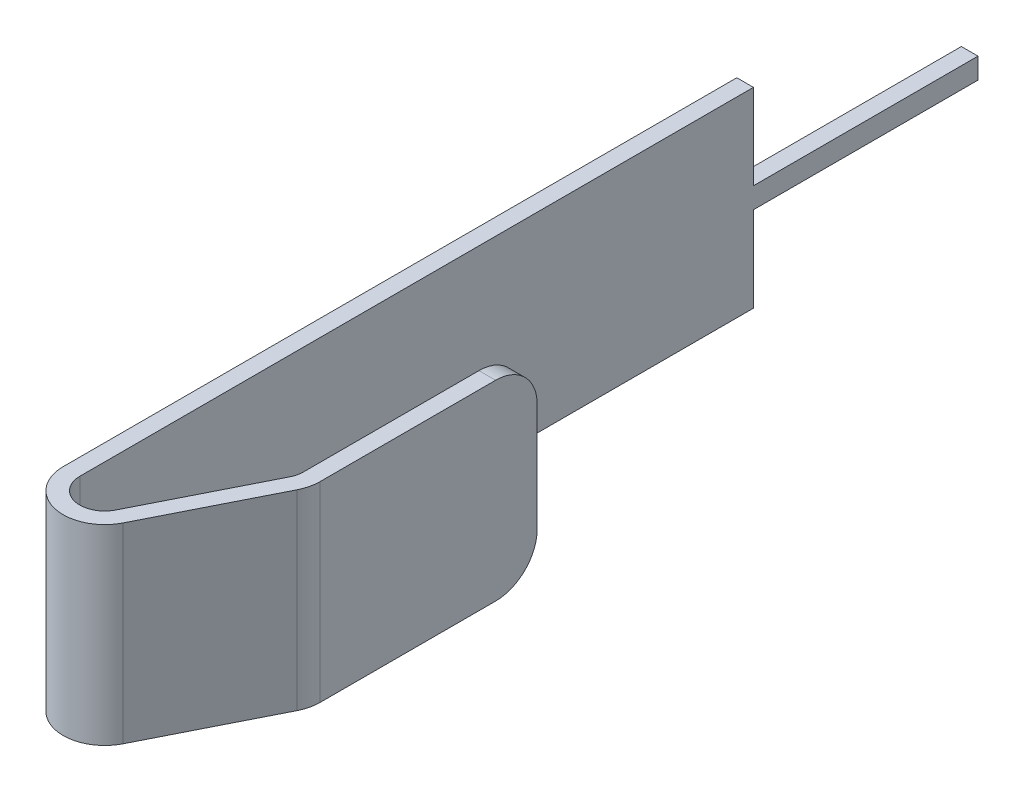
from build123d import *

# Parameters (mm, degrees)
EXTRUDE_THIN1_DEPTH = 2.921
FILLET1_R           = 1.27
SKETCH2_W           = 6.858
SKETCH2_H           = 2.6035
CUT_EXTRUDE1_DEPTH  = 23.45746426


with BuildPart() as part:
    # Sketch1 → Extrude-Thin1 (new, symmetric)
    with BuildSketch(Plane(origin=(0, 0, 0), x_dir=(1, 0, 0), z_dir=(0, 1, 0))):
        with BuildLine():
            Line((0, 6.858), (0, 0))
            Line((0, 0), (0, -20.574))
            ThreePointArc((0, -20.574), (0.976529529, -21.809627404), (2.404370209, -21.145055365))
            Line((2.404370209, -21.145055365), (4.182370209, -17.613155736))
            ThreePointArc((4.182370209, -17.613155736), (4.283627404, -17.335570842), (4.318, -17.042100371))
            Line((4.318, -17.042100371), (4.318, -10.414))
            Line((4.318, -10.414), (3.81, -10.414))
            Line((3.81, -10.414), (3.81, -17.042100371))
            ThreePointArc((3.81, -17.042100371), (3.789376443, -17.218182654), (3.728622125, -17.38473359))
            Line((3.728622125, -17.38473359), (1.950622125, -20.916633219))
            ThreePointArc((1.950622125, -20.916633219), (1.093917717, -21.315376443), (0.508, -20.574))
            Line((0.508, -20.574), (0.508, 0))
            Line((0.508, 0), (0.508, 6.858))
            Line((0.508, 6.858), (0, 6.858))
        make_face()
    extrude(amount=EXTRUDE_THIN1_DEPTH, both=True)

    # Fillet1
    fillet1_edges = [part.edges().sort_by_distance(p)[0] for p in [
        (4.064, -2.921, 10.414),
        (4.064, 2.921, 10.414),
    ]]
    fillet(fillet1_edges, radius=FILLET1_R)

    # Sketch2 → Cut-Extrude1 (cut, through all)
    with BuildSketch(Plane.ZY):
        with Locations((-3.429, 1.61925)):
            Rectangle(SKETCH2_W, SKETCH2_H)
        with Locations((-3.429, -1.61925)):
            Rectangle(SKETCH2_W, SKETCH2_H)
    extrude(amount=-CUT_EXTRUDE1_DEPTH, mode=Mode.SUBTRACT)


solid = part.part
